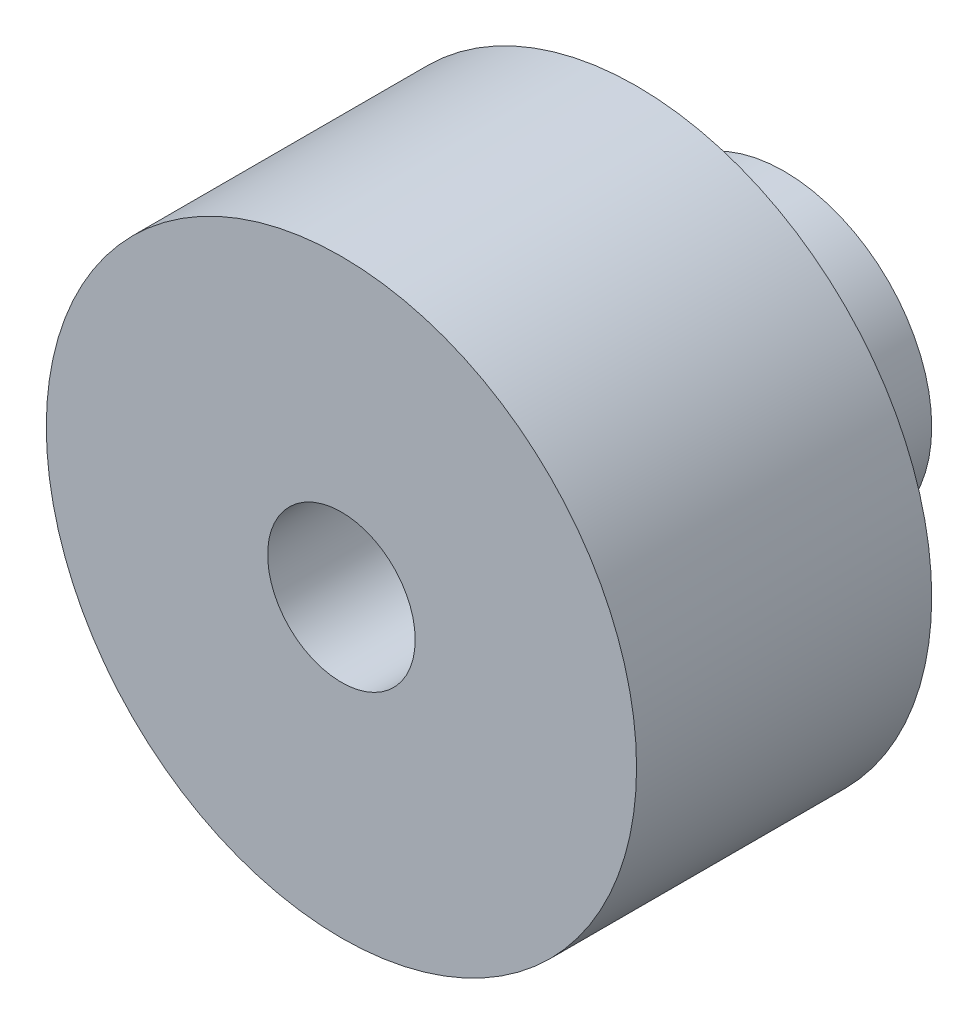
from build123d import *

# Parameters (mm, degrees)
SKETCH1_R               = 20
BOSS_EXTRUDE1_DEPTH     = 20
SKETCH2_R               = 5
CUT_EXTRUDE1_DEPTH      = 20
SKETCH3_R               = 10
SKETCH3_R_2             = 5
BOSS_EXTRUDE2_DEPTH     = 10
CUT_EXTRUDE2_REACH      = 43.231
CUT_EXTRUDE2_END_RADIUS = 5
SKETCH5_R               = 1


with BuildPart() as part:
    # Sketch1 → Boss-Extrude1 (new body)
    with BuildSketch(Plane.XY):
        Circle(SKETCH1_R)
    extrude(amount=BOSS_EXTRUDE1_DEPTH)

    # Sketch2 → Cut-Extrude1 (cut)
    with BuildSketch(Plane.XY.offset(20)):
        Circle(SKETCH2_R)
    extrude(amount=-CUT_EXTRUDE1_DEPTH, mode=Mode.SUBTRACT)

    # Sketch3 → Boss-Extrude2 (add)
    with BuildSketch(Plane(origin=(0, 0, 0), x_dir=(-1, 0, 0), z_dir=(0, 0, -1))):
        with Locations(Location((0, 0, 0), (0, 0, 180))):
            Circle(SKETCH3_R)
        with Locations(Location((0, 0, 0), (0, 0, 180))):
            Circle(SKETCH3_R_2, mode=Mode.SUBTRACT)
    extrude(amount=BOSS_EXTRUDE2_DEPTH)

    # Cut-Extrude2: up to this cylinder (the profile starts outside it)
    cut_extrude2_end = Plane(origin=(0, 0, -5), z_dir=(0, 0, 1)) * Cylinder(CUT_EXTRUDE2_END_RADIUS, 97.462, mode=Mode.PRIVATE)
    # Sketch5 → Cut-Extrude2 (cut, up to the surface)
    with BuildSketch(Plane(origin=(10, 0, 0), x_dir=(0, 0, -1), z_dir=(1, 0, 0)), mode=Mode.PRIVATE) as cut_extrude2_sk1:
        with Locations((5, 0)):
            Circle(SKETCH5_R)
    cut_extrude2_tool1 = extrude(cut_extrude2_sk1.sketch, amount=-CUT_EXTRUDE2_REACH, mode=Mode.PRIVATE) - cut_extrude2_end
    add(cut_extrude2_tool1.solids().sort_by_distance((10, 0, -5))[0], mode=Mode.SUBTRACT)


solid = part.part
